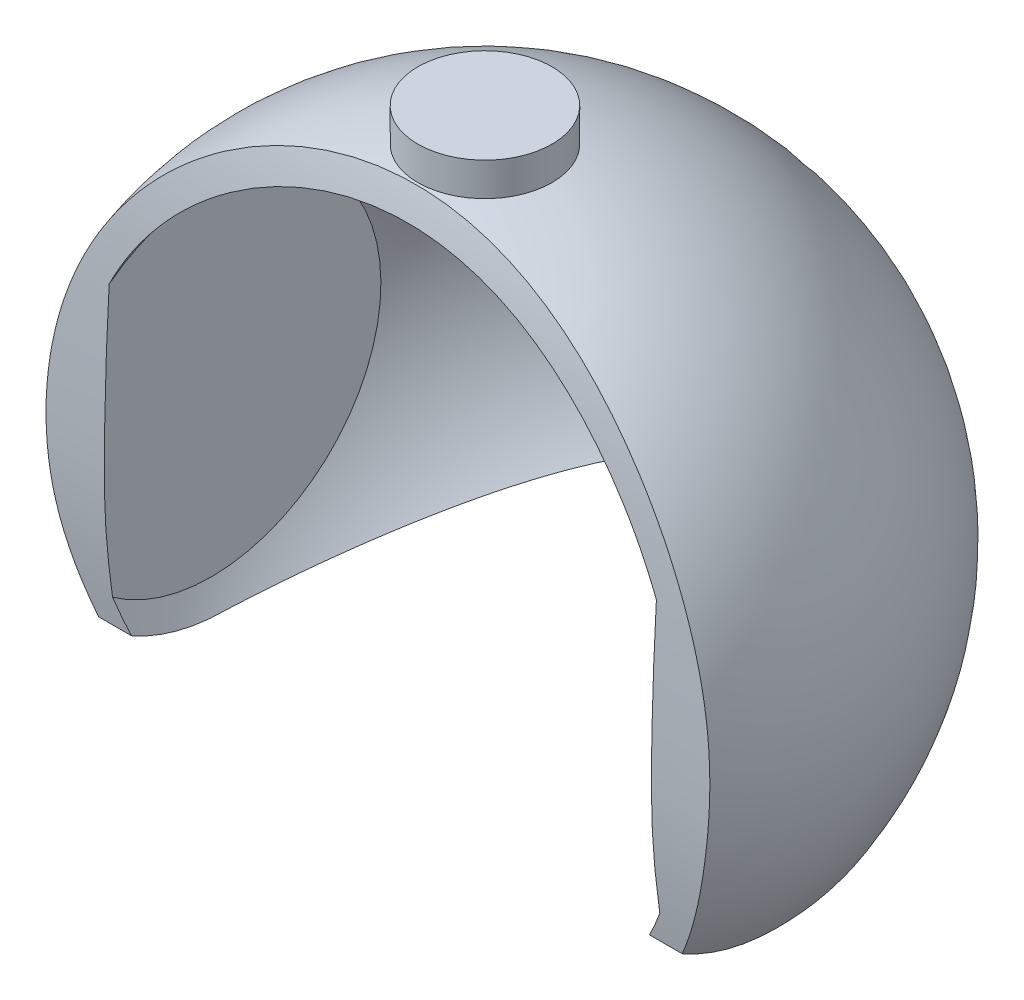
from build123d import *

# Parameters (mm, degrees)
CUT_EXTRUDE_1_DEPTH  = 185.5
CUT_EXTRUDE_2_DEPTH  = 185.5
EXTRUDE_3_REACH      = 165.325
EXTRUDE_3_END_RADIUS = 65
SKETCH_8_R           = 12.5


with BuildPart() as part:
    # 草图1 → 旋转1 (revolve)
    with BuildSketch(Plane.XY):
        with BuildLine():
            Line((65, 0), (-65, 0))
            ThreePointArc((-65, 0), (0, 65), (65, 0))
        make_face()
    revolve(axis=Axis((65, 0, 0), (-1, 0, 0)))

    # 草图2 → 切除-拉伸1 (cut, symmetric)
    with BuildSketch(Plane(origin=(0, 0, 0), x_dir=(0, 0, -1), z_dir=(1, 0, 0))):
        with BuildLine():
            ThreePointArc((-12.89631771, 63.707809486), (-65, 0), (-12.89631771, -63.707809486))
            add(Edge.make_bspline(
                [(-12.89631771, 63.707809486), (-18.068830366, 46.448952548), (-19.316294631, 24.943789543), (-20.039305153, -0.944470081), (-19.85450826, -25.927331071), (-14.076661929, -46.863568602), (-12.89631771, -63.707809486)],
                knots=[0, 0, 0, 0, 0.417599602, 0.500366721, 0.605327847, 1, 1, 1, 1], degree=3))
        make_face()
    extrude(amount=CUT_EXTRUDE_1_DEPTH, both=True, mode=Mode.SUBTRACT)

    # 草图3 → 切除-旋转1 (revolve, cut)
    with BuildSketch(Plane.XY, mode=Mode.PRIVATE) as cut_revolve_1_sk:
        with BuildLine():
            Line((51, 0), (51, 31.606961259))
            ThreePointArc((51, 31.606961259), (0, 60), (-51, 31.606961259))
            Line((-51, 31.606961259), (-51, 0))
            Line((-51, 0), (51, 0))
        make_face()
    revolve(cut_revolve_1_sk.sketch.rotate(Axis((-61.860271247, 0, 0), (1, 0, 0)), 275.721848348), axis=Axis((-61.860271247, 0, 0), (1, 0, 0)), mode=Mode.SUBTRACT)

    # 草图5 → 切除-拉伸2 (cut, symmetric)
    with BuildSketch(Plane(origin=(0, 0, 0), x_dir=(0, 0, -1), z_dir=(1, 0, 0))):
        with BuildLine():
            ThreePointArc((0, -35.606194759), (-9.274492384, -34.377098427), (-17.908689187, -30.774664203))
            Line((-17.908689187, -30.774664203), (-28.107954259, -58.608385982))
            ThreePointArc((-28.107954259, -58.608385982), (29.46312981, -57.938967731), (63.917840825, -11.811419231))
            add(Edge.make_bspline(
                [(0, -35.606194759), (22.524874091, -36.181761443), (48.586298175, -29.491655869), (63.917840825, -11.811419231)],
                knots=[0, 0, 0, 0, 1, 1, 1, 1], degree=3))
        make_face()
    extrude(amount=CUT_EXTRUDE_2_DEPTH, both=True, mode=Mode.SUBTRACT)

    # 凸台-拉伸3: up to this sphere (the profile starts outside it)
    extrude_3_end = Location((0, 0, 0)) * Sphere(EXTRUDE_3_END_RADIUS, mode=Mode.PRIVATE)
    # 草图8 → 凸台-拉伸3 (add, up to the surface)
    with BuildSketch(Plane(origin=(0, 70, 0), x_dir=(1, 0, 0), z_dir=(0, 1, 0)), mode=Mode.PRIVATE) as extrude_3_sk1:
        with Locations(Location((0, 0, 0), (0, 0, 270))):
            Circle(SKETCH_8_R)
    extrude_3_tool1 = extrude(extrude_3_sk1.sketch, amount=-EXTRUDE_3_REACH, mode=Mode.PRIVATE) - extrude_3_end
    add(extrude_3_tool1.solids().sort_by_distance((0, 70, 0))[0])


solid = part.part
